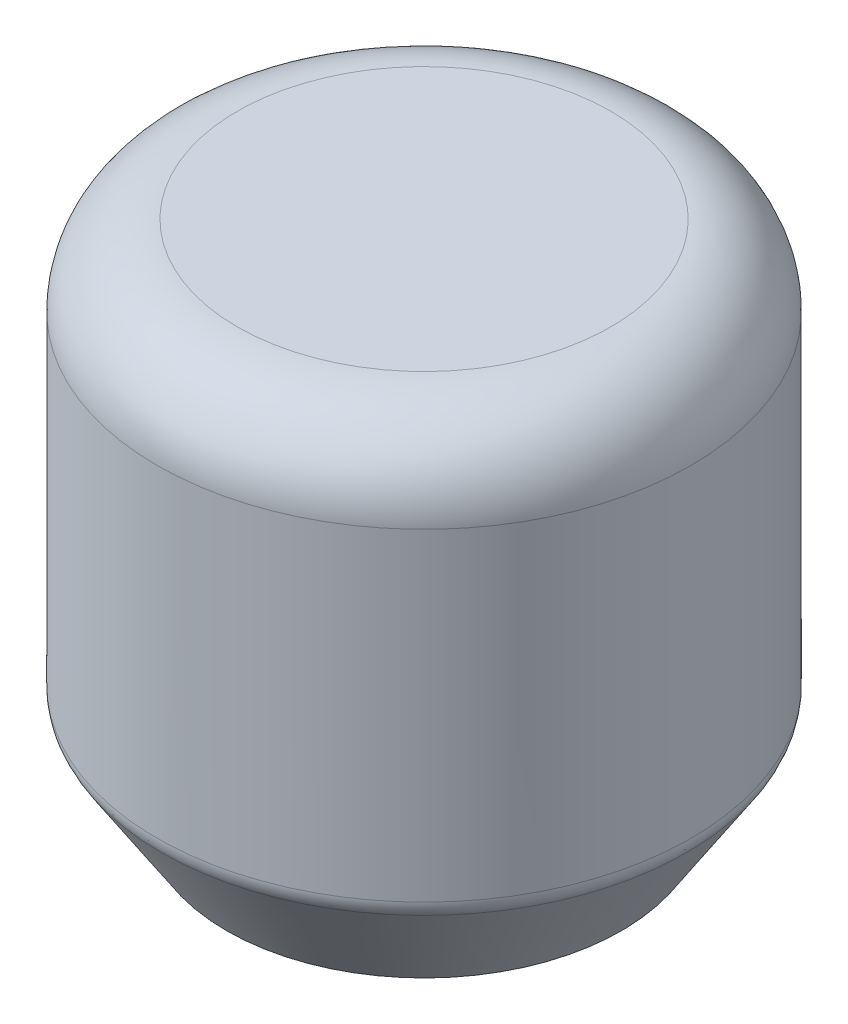
from build123d import *

# Parameters (mm, degrees)
SKETCH1_R           = 127
BOSS_EXTRUDE1_DEPTH = 246.38
FILLET1_R           = 38.1
CHAMFER1_SIZE       = 33.02
CHAMFER1_SIZE2      = 50.846341105
FILLET2_R           = 12.7


with BuildPart() as part:
    # Sketch1 → Boss-Extrude1 (new body)
    with BuildSketch(Plane(origin=(0, 0, 0), x_dir=(1, 0, 0), z_dir=(0, 1, 0))):
        with Locations(Location((0, 0, 0), (0, 0, 90))):
            Circle(SKETCH1_R)
    extrude(amount=BOSS_EXTRUDE1_DEPTH)

    # Fillet1
    fillet1_edges = [part.edges().sort_by_distance(p)[0] for p in [
        (0, 246.38, 127),
    ]]
    fillet(fillet1_edges, radius=FILLET1_R)

    # Chamfer1
    chamfer1_edges = [part.edges().sort_by_distance(p)[0] for p in [
        (0, 0, 127),
    ]]
    chamfer1_side = [part.faces().sort_by_distance(p)[0] for p in [
        (0, 0, 0),
    ]]
    chamfer(chamfer1_edges, length=CHAMFER1_SIZE, length2=CHAMFER1_SIZE2, reference=chamfer1_side[0])

    # Fillet2
    fillet2_edges = [part.edges().sort_by_distance(p)[0] for p in [
        (0, 50.846341105, 127),
    ]]
    fillet(fillet2_edges, radius=FILLET2_R)


solid = part.part
